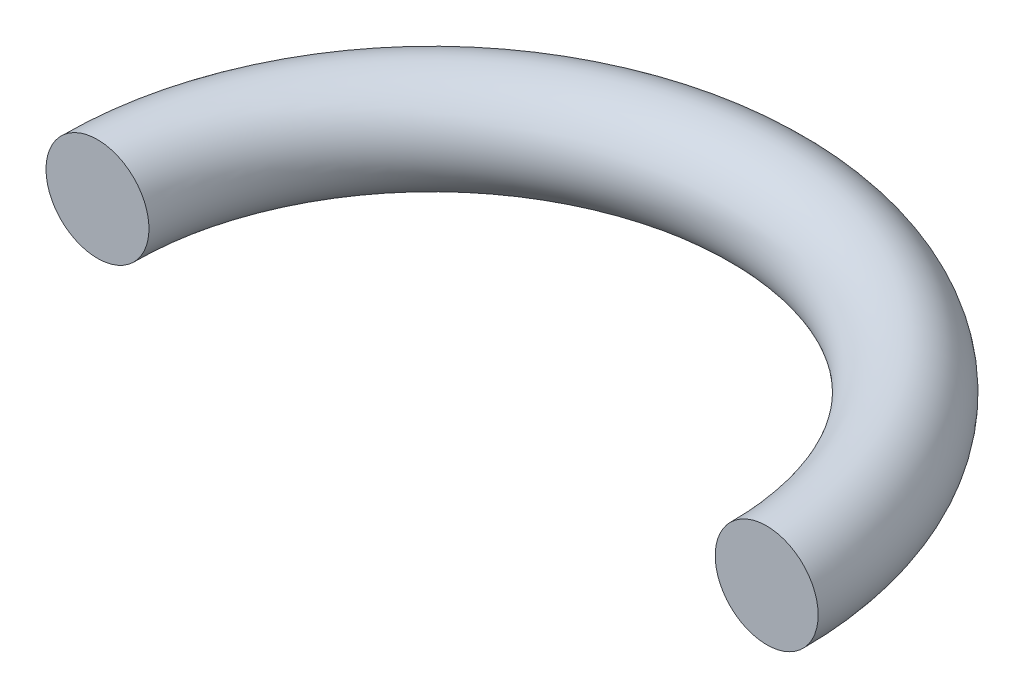
from build123d import *

# Parameters (mm, degrees)
SKETCH1_R      = 4
REVOLVE1_ANGLE = 180


with BuildPart() as part:
    # Sketch1 → Revolve1 (revolve)
    with BuildSketch(Plane.XY):
        with Locations((-26, 0)):
            Circle(SKETCH1_R)
    revolve(axis=Axis((0, 0, 0), (0, -1, 0)), revolution_arc=REVOLVE1_ANGLE)


solid = part.part
